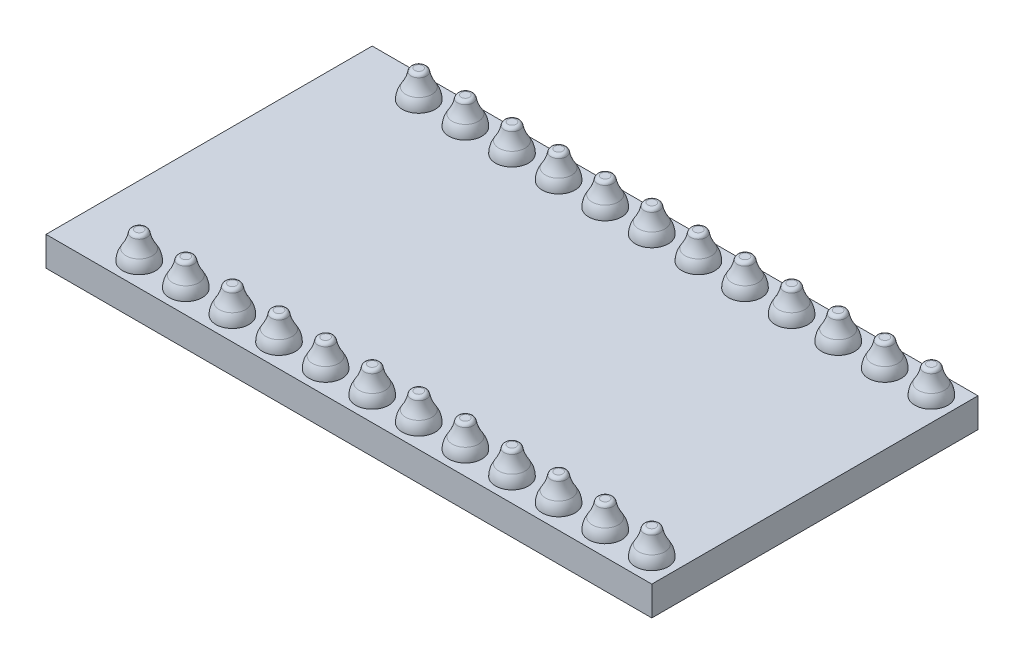
from build123d import *

# Parameters (mm, degrees)
SKETCH1_W            = 33.02
SKETCH1_H            = 17.78
BOSS_EXTRUDE2_DEPTH  = 1.6
SKETCH2_R            = 0.45
CUT_EXTRUDE2_DEPTH   = 1.6
LPATTERN3_COUNT      = 12
LPATTERN3_PITCH      = 2.54
LPATTERN2_COUNT      = 2
LPATTERN2_PITCH      = 15.24
LPATTERN2_COUNT_DIR2 = 12
LPATTERN2_PITCH_DIR2 = 2.54


with BuildPart() as part:
    # Sketch1 → Boss-Extrude2 (new body)
    with BuildSketch(Plane(origin=(0, 0, 0), x_dir=(1, 0, 0), z_dir=(0, 1, 0))):
        with Locations((12.7, 7.62)):
            Rectangle(SKETCH1_W, SKETCH1_H)
    extrude(amount=BOSS_EXTRUDE2_DEPTH)

    # Sketch2 → Cut-Extrude2 (cut)
    with BuildSketch(Plane(origin=(0, 0, 0), x_dir=(1, 0, 0), z_dir=(0, 1, 0))):
        with Locations(Location((0, 0, 0), (0, 0, 270))):
            Circle(SKETCH2_R)
        with Locations(Location((0, 15.24, 0), (0, 0, 270))):
            Circle(SKETCH2_R)
    cut_extrude2 = extrude(amount=CUT_EXTRUDE2_DEPTH, mode=Mode.SUBTRACT)

    # LPattern3: Cut-Extrude2 ×12
    with Locations(*[(i * LPATTERN3_PITCH, 0, 0) for i in range(1, LPATTERN3_COUNT)]):
        add(cut_extrude2, mode=Mode.SUBTRACT)

    # Sketch6 → Revolve1 (revolve)
    with BuildSketch(Plane(origin=(0, 0, 0), x_dir=(0, 0, -1), z_dir=(1, 0, 0))):
        with BuildLine():
            Line((0, 1.6), (0.9, 1.6))
            ThreePointArc((0.9, 1.6), (0.852442497, 1.91994498), (0.713882199, 2.212224898))
            ThreePointArc((0.713882199, 2.212224898), (0.530499248, 2.558589224), (0.422081551, 2.93520993))
            ThreePointArc((0.422081551, 2.93520993), (0.353575878, 3.053365554), (0.225205293, 3.1))
            Line((0.225205293, 3.1), (0, 3.1))
            Line((0, 3.1), (0, 1.6))
        make_face()
    revolve1 = revolve(axis=Axis((0, 1.372239532, 0), (0, 1, 0)))

    # LPattern2: Revolve1 2 × 12
    with Locations(*[(j * LPATTERN2_PITCH_DIR2, 0, -i * LPATTERN2_PITCH) for i in range(LPATTERN2_COUNT) for j in range(LPATTERN2_COUNT_DIR2) if (i, j) != (0, 0)]):
        add(revolve1)


solid = part.part
